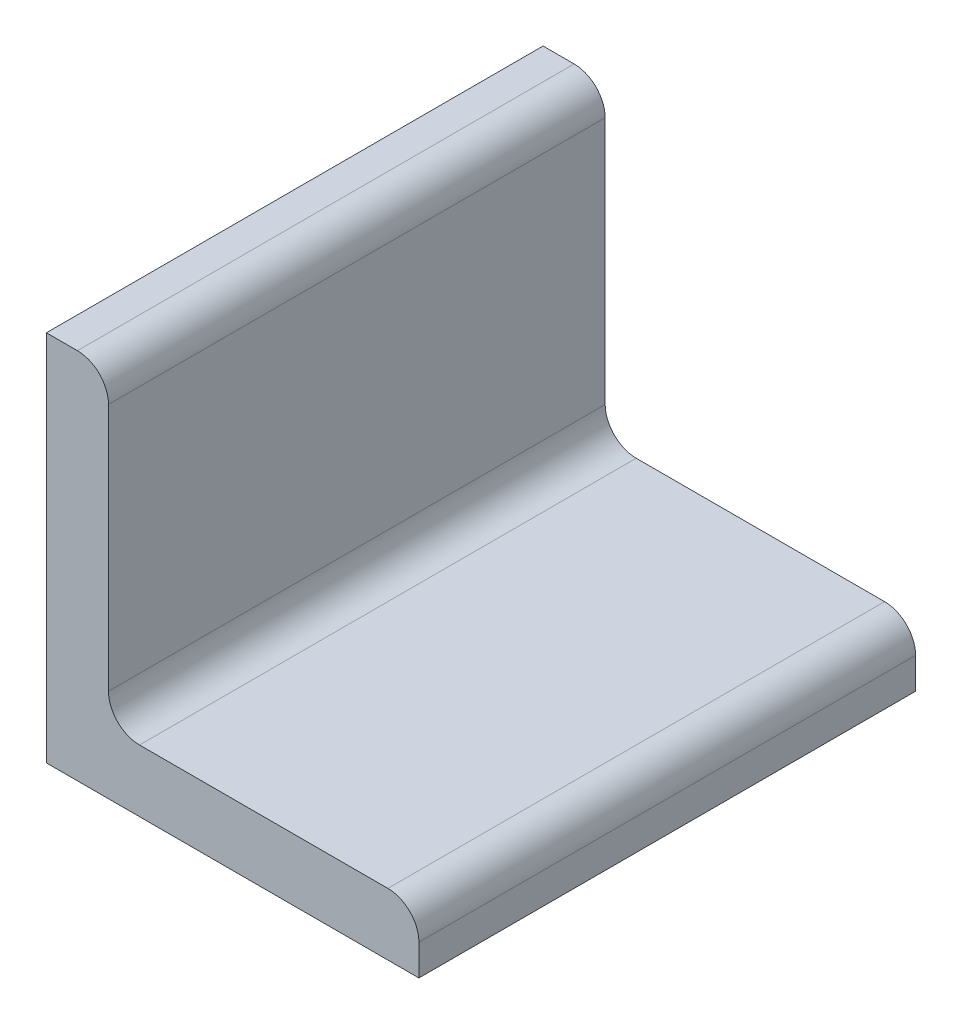
from build123d import *

# Parameters (mm, degrees)
BOSS_EXTRUDE1_DEPTH = 12.7
FILLET1_R           = 1.5875


with BuildPart() as part:
    # Sketch3 → Boss-Extrude1 (new, symmetric)
    with BuildSketch(Plane.XY):
        Polygon((3.175, 19.05), (0, 19.05), (0, 0), (19.05, 0), (19.05, 3.175), (3.175, 3.175), align=None)
    extrude(amount=BOSS_EXTRUDE1_DEPTH, both=True)

    # Fillet1
    fillet1_edges = [part.edges().sort_by_distance(p)[0] for p in [
        (3.175, 3.175, 0),
        (19.05, 3.175, 0),
        (3.175, 19.05, 0),
    ]]
    fillet(fillet1_edges, radius=FILLET1_R)


solid = part.part
